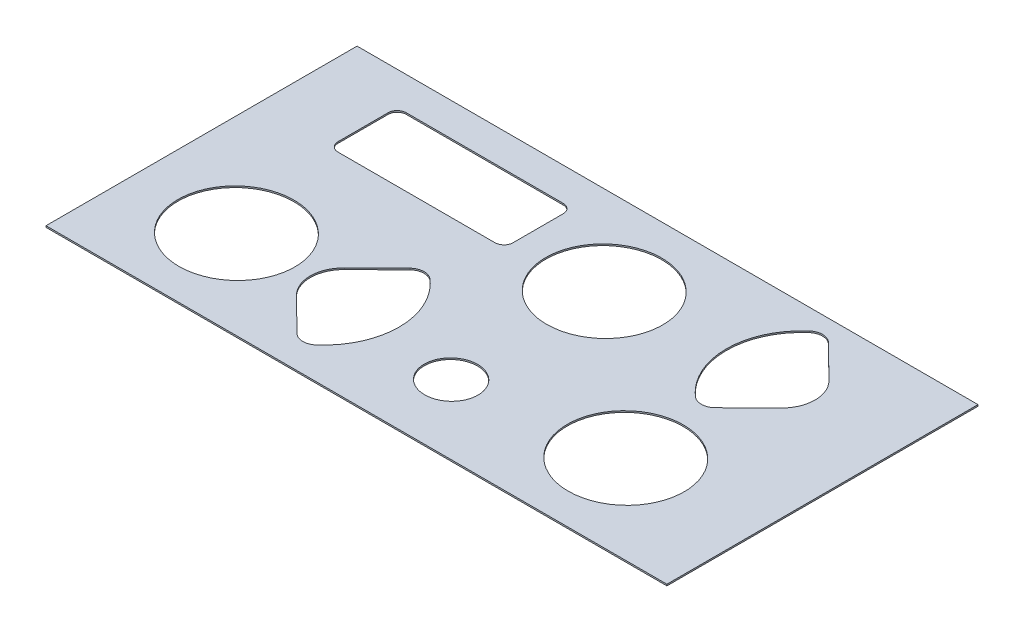
from build123d import *

# Parameters (mm, degrees)
SKETCH1_W           = 122.52211349
SKETCH1_H           = 62.426086957
SKETCH1_R           = 11.538006617
SKETCH1_R_2         = 5.3
BOSS_EXTRUDE1_DEPTH = 0.3
SCALE1_SCALE_X      = 1.017
SCALE1_SCALE_Y      = 1
SCALE1_SCALE_Z      = 1


with BuildPart() as part:
    # Sketch1 → Boss-Extrude1 (new body)
    with BuildSketch(Plane(origin=(0, 0, 0), x_dir=(1, 0, 0), z_dir=(0, 1, 0))):
        with Locations((0, -31.413043479)):
            Rectangle(SKETCH1_W, SKETCH1_H)
        with Locations(Location((-41.192576644, -44.822057743, 0), (0, 0, 270))):
            Circle(SKETCH1_R, mode=Mode.SUBTRACT)
        with Locations(Location((5.00831061, -18, 0), (0, 0, 270))):
            Circle(SKETCH1_R, mode=Mode.SUBTRACT)
        with Locations(Location((5.008174328, -48.717286319, 0), (0, 0, 270))):
            Circle(SKETCH1_R_2, mode=Mode.SUBTRACT)
        with Locations(Location((35.638838982, -44.826086957, 0), (0, 0, 270))):
            Circle(SKETCH1_R, mode=Mode.SUBTRACT)
        with BuildLine():
            Line((-46.813141343, -8.641505024), (-46.813141343, -18.735152295))
            ThreePointArc((-46.813141343, -18.735152295), (-46.285933549, -20.007944501), (-45.013141343, -20.535152295))
            Line((-45.013141343, -20.535152295), (-14.073943972, -20.535152295))
            ThreePointArc((-14.073943972, -20.535152295), (-12.801151766, -20.007944501), (-12.273943972, -18.735152295))
            Line((-12.273943972, -18.735152295), (-12.273943972, -8.641505024))
            ThreePointArc((-12.273943972, -8.641505024), (-12.801151766, -7.368712818), (-14.073943972, -6.841505024))
            Line((-14.073943972, -6.841505024), (-45.013141343, -6.841505024))
            ThreePointArc((-45.013141343, -6.841505024), (-46.285933549, -7.368712818), (-46.813141343, -8.641505024))
        make_face(mode=Mode.SUBTRACT)
        with BuildLine():
            Line((35.892026763, -4.418435842), (42.419318633, -10.945727712))
            ThreePointArc((42.419318633, -10.945727712), (44.410992521, -15.754053824), (42.419318633, -20.562379936))
            Line((42.419318633, -20.562379936), (35.89506492, -27.086633649))
            ThreePointArc((35.89506492, -27.086633649), (34.002929819, -27.904853147), (32.063874335, -27.205051591))
            ThreePointArc((32.063874335, -27.205051591), (26.898857881, -15.754591648), (32.05703082, -4.301047227))
            ThreePointArc((32.05703082, -4.301047227), (33.997795205, -3.599645655), (35.892026763, -4.418435842))
        make_face(mode=Mode.SUBTRACT)
        with BuildLine():
            Line((-18.093561518, -56.158666781), (-24.61781523, -49.634413069))
            ThreePointArc((-24.61781523, -49.634413069), (-26.609489118, -44.826086957), (-24.61781523, -40.017760844))
            Line((-24.61781523, -40.017760844), (-18.09052336, -33.490468974))
            ThreePointArc((-18.09052336, -33.490468974), (-16.196291802, -32.671678788), (-14.255527417, -33.37308036))
            ThreePointArc((-14.255527417, -33.37308036), (-9.097354478, -44.826624781), (-14.262370932, -56.277084723))
            ThreePointArc((-14.262370932, -56.277084723), (-16.201426417, -56.976886279), (-18.093561518, -56.158666781))
        make_face(mode=Mode.SUBTRACT)
    extrude(amount=BOSS_EXTRUDE1_DEPTH)


with BuildPart() as part_1:
    # Scale1: scaled about (1.615129931, 0.15, 31.766301579)
    add(part.part.scale((SCALE1_SCALE_X, SCALE1_SCALE_Y, SCALE1_SCALE_Z), about=(1.615129931, 0.15, 31.766301579)))


solid = part_1.part
